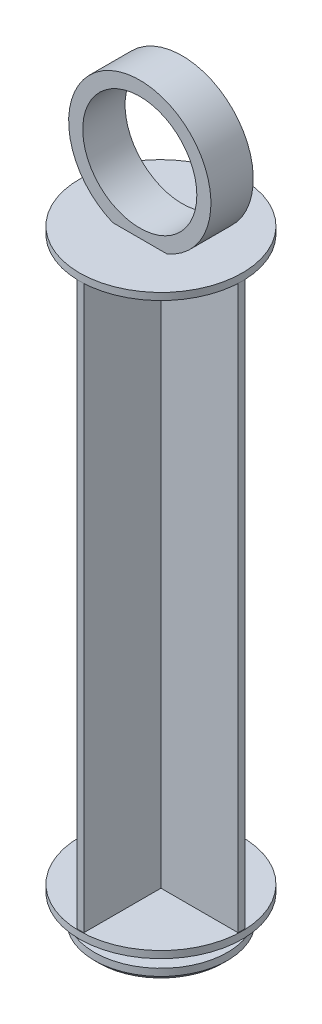
from build123d import *

# Parameters (mm, degrees)
BOSS_EXTRUDE1_DEPTH = 59.85
SKETCH2_R           = 17.3
BOSS_EXTRUDE2_DEPTH = 1.5
SKETCH3_R           = 15.13
SKETCH3_R_2         = 12.13
BOSS_EXTRUDE3_DEPTH = 4.5


with BuildPart() as part:
    # Sketch1 → Boss-Extrude1 (new, symmetric)
    with BuildSketch(Plane(origin=(0, 0, 0), x_dir=(1, 0, 0), z_dir=(0, 1, 0))):
        Polygon((-0.75, 0.75), (-17.15, 0.75), (-17.15, -0.75), (-0.75, -0.75), (-0.75, -17.15), (0.75, -17.15), (0.75, -0.75), (17.15, -0.75), (17.15, 0.75), (0.75, 0.75), (0.75, 17.15), (-0.75, 17.15), align=None)
    extrude(amount=BOSS_EXTRUDE1_DEPTH, both=True)

    # Sketch2 → Boss-Extrude2 (add)
    with BuildSketch(Plane(origin=(0, 59.85, 0), x_dir=(1, 0, 0), z_dir=(0, 1, 0))):
        with Locations(Location((0, 0, 0), (0, 0, 270))):
            Circle(SKETCH2_R)
    boss_extrude2 = extrude(amount=BOSS_EXTRUDE2_DEPTH)

    # Mirror1: Boss-Extrude2 across plane
    add(boss_extrude2.mirror(Plane.ZX))

    # Sketch3 → Boss-Extrude3 (add, symmetric)
    with BuildSketch(Plane.XY):
        with Locations((0, 75.35)):
            Circle(SKETCH3_R)
        with Locations((0, 75.35)):
            Circle(SKETCH3_R_2, mode=Mode.SUBTRACT)
    extrude(amount=BOSS_EXTRUDE3_DEPTH, both=True)

    # Sketch4 → Revolve1 (revolve)
    with BuildSketch(Plane(origin=(0, 0, 0), x_dir=(0, 0, -1), z_dir=(1, 0, 0))):
        Polygon((-5.95, -61.35), (-5.95, -65.35), (-14.15, -65.35), (-14.15, -66.85), (-13.15, -67.85), (0, -67.85), (0, -61.35), align=None)
    revolve(axis=Axis((0, -54.373859454, 0), (0, -1, 0)))


solid = part.part
